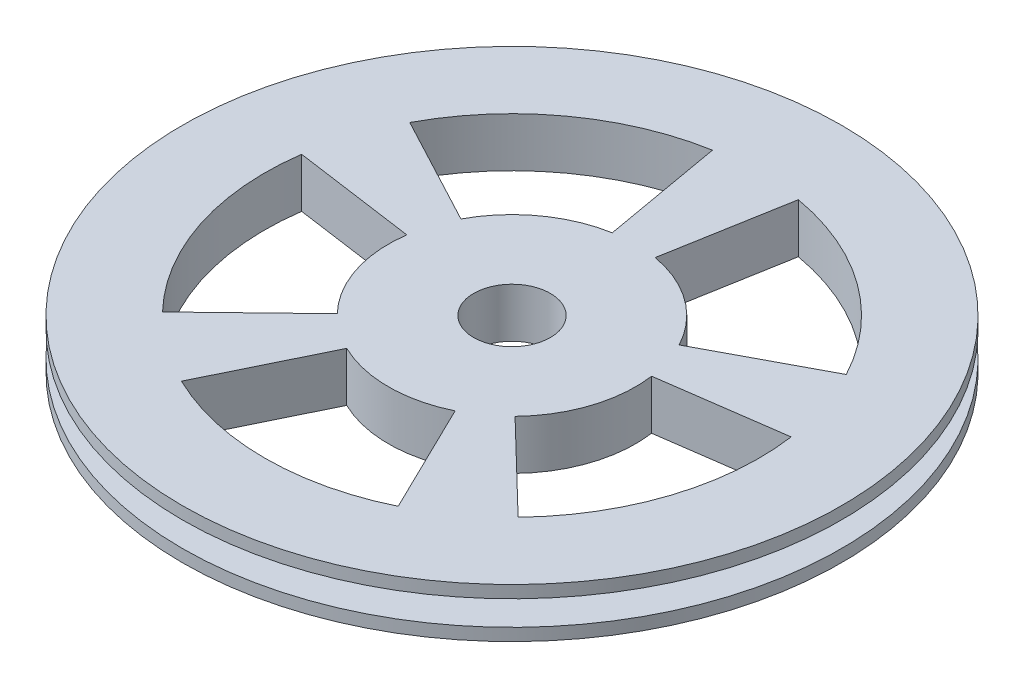
from build123d import *

# Parameters (mm, degrees)
SKETCH2_R           = 20
SKETCH2_R_2         = 2.325
BOSS_EXTRUDE1_DEPTH = 3
SKETCH3_W           = 3
SKETCH3_H           = 1.5


with BuildPart() as part:
    # Sketch2 → Boss-Extrude1 (new body)
    with BuildSketch(Plane(origin=(0, 0, 0), x_dir=(1, 0, 0), z_dir=(0, 1, 0))):
        with Locations(Location((0, 0, 0), (0, 0, 270))):
            Circle(SKETCH2_R)
        with Locations(Location((0, 0, 0), (0, 0, 270))):
            Circle(SKETCH2_R_2, mode=Mode.SUBTRACT)
        with BuildLine():
            Line((-1.302361333, 7.386058148), (-2.604722665, 14.772116295))
            ThreePointArc((-2.604722665, 14.772116295), (-8.816778784, 12.135254916), (-13.244213893, 7.042073442))
            Line((-13.244213893, 7.042073442), (-6.622106946, 3.521036721))
            ThreePointArc((-6.622106946, 3.521036721), (-4.408389392, 6.067627458), (-1.302361333, 7.386058148))
        make_face(mode=Mode.SUBTRACT)
        with BuildLine():
            Line((1.302361333, 7.386058148), (2.604722665, 14.772116295))
            ThreePointArc((2.604722665, 14.772116295), (8.816778784, 12.135254916), (13.244213893, 7.042073442))
            Line((13.244213893, 7.042073442), (6.622106946, 3.521036721))
            ThreePointArc((6.622106946, 3.521036721), (4.408389392, 6.067627458), (1.302361333, 7.386058148))
        make_face(mode=Mode.SUBTRACT)
        with BuildLine():
            Line((7.427010516, 1.043798257), (14.854021031, 2.087596514))
            ThreePointArc((14.854021031, 2.087596514), (14.265847744, -4.635254916), (10.790097005, -10.419875557))
            Line((10.790097005, -10.419875557), (5.395048503, -5.209937778))
            ThreePointArc((5.395048503, -5.209937778), (7.132923872, -2.317627458), (7.427010516, 1.043798257))
        make_face(mode=Mode.SUBTRACT)
        with BuildLine():
            Line((3.287783601, -6.740955347), (6.575567202, -13.481910694))
            ThreePointArc((6.575567202, -13.481910694), (0, -15), (-6.575567202, -13.481910694))
            Line((-6.575567202, -13.481910694), (-3.287783601, -6.740955347))
            ThreePointArc((-3.287783601, -6.740955347), (0, -7.5), (3.287783601, -6.740955347))
        make_face(mode=Mode.SUBTRACT)
        with BuildLine():
            Line((-5.395048503, -5.209937778), (-10.790097005, -10.419875557))
            ThreePointArc((-10.790097005, -10.419875557), (-14.265847744, -4.635254916), (-14.854021031, 2.087596514))
            Line((-14.854021031, 2.087596514), (-7.427010516, 1.043798257))
            ThreePointArc((-7.427010516, 1.043798257), (-7.132923872, -2.317627458), (-5.395048503, -5.209937778))
        make_face(mode=Mode.SUBTRACT)
    extrude(amount=BOSS_EXTRUDE1_DEPTH)

    # Sketch3 → Cut-Revolve1 (revolve, cut)
    with BuildSketch(Plane.XY, mode=Mode.PRIVATE) as cut_revolve1_sk:
        with Locations((18.5, 1.5)):
            Rectangle(SKETCH3_W, SKETCH3_H)
    revolve(cut_revolve1_sk.sketch.rotate(Axis((0, 0, 0), (0, 1, 0)), 90), axis=Axis((0, 0, 0), (0, 1, 0)), mode=Mode.SUBTRACT)


solid = part.part
